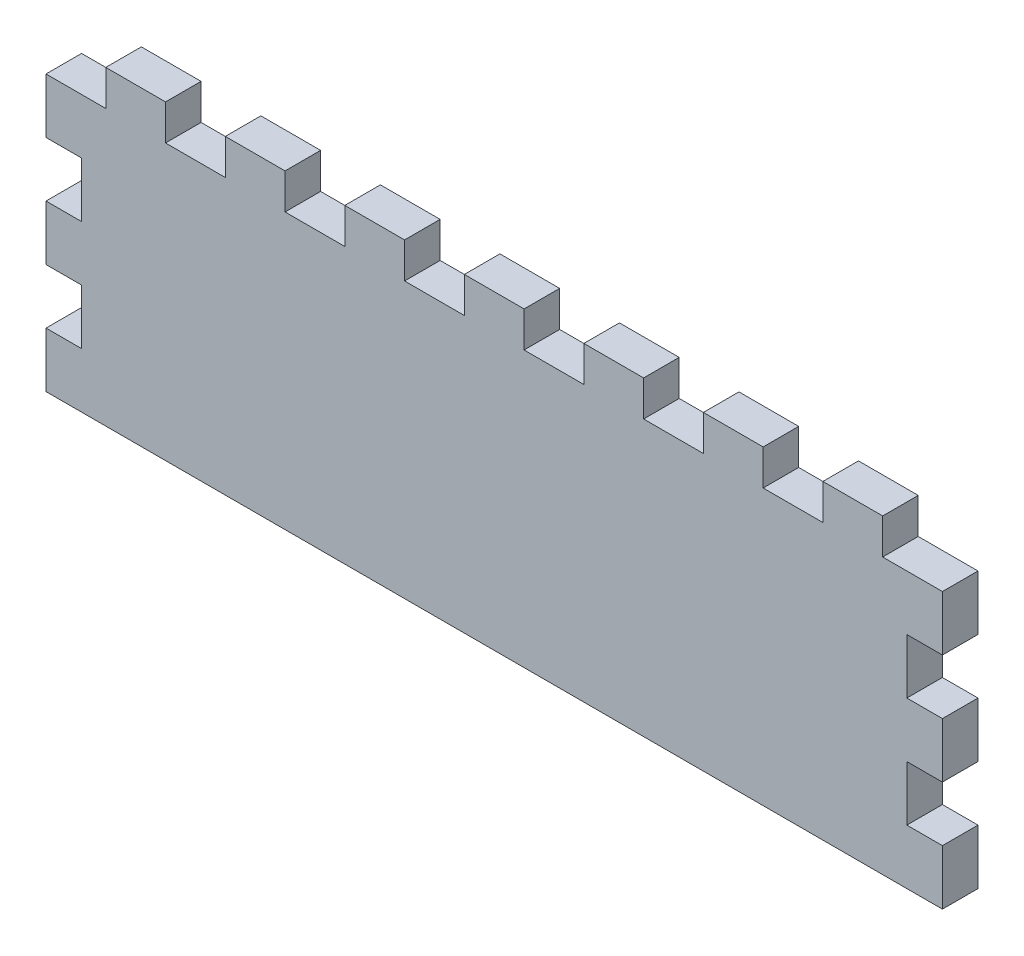
from build123d import *

# Parameters (mm, degrees)
SKETCH1_W               = 80
SKETCH1_H               = 80
BOSS_EXTRUDE1_DEPTH     = 3.175
CUT_EXTRUDE2_DEPTH      = 57.657573413
CUT_EXTRUDE2_DEPTH_BACK = 57.657573413
SKETCH3_W               = 5.333333333
SKETCH3_H               = 3.175
SKETCH3_W_2             = 3.175
SKETCH3_H_2             = 4.91
SKETCH3_W_3             = 5.333333334
SKETCH4_W               = 80.351781832
SKETCH4_H               = 52.368780003
CUT_EXTRUDE3_DEPTH      = 57.657573413


with BuildPart() as part:
    # Sketch1 → Boss-Extrude1 (new body)
    with BuildSketch(Plane.XY):
        Rectangle(SKETCH1_W, SKETCH1_H)
    extrude(amount=BOSS_EXTRUDE1_DEPTH)

    # Sketch3 → Cut-Extrude2 (cut, two sides: drawn at the far end of the back side and taken through both)
    with BuildSketch(Plane.XY.offset(3.175).offset(-CUT_EXTRUDE2_DEPTH_BACK)):
        with Locations((-37.333333334, -38.4125)):
            Rectangle(SKETCH3_W, SKETCH3_H)
        with Locations((-26.666666666, -38.4125)):
            Rectangle(SKETCH3_W, SKETCH3_H)
        with Locations((-38.4125, -29.46)):
            Rectangle(SKETCH3_W_2, SKETCH3_H_2)
        with Locations((-16, -38.4125)):
            Rectangle(SKETCH3_W_3, SKETCH3_H)
        with Locations((-38.4125, -19.64)):
            Rectangle(SKETCH3_W_2, SKETCH3_H_2)
        with Locations((-5.333333334, -38.4125)):
            Rectangle(SKETCH3_W, SKETCH3_H)
        with Locations((-38.4125, -9.82)):
            Rectangle(SKETCH3_W_2, SKETCH3_H_2)
        with Locations((5.333333334, -38.4125)):
            Rectangle(SKETCH3_W, SKETCH3_H)
        with Locations((-38.4125, 0)):
            Rectangle(SKETCH3_W_2, SKETCH3_H_2)
        with Locations((16, -38.4125)):
            Rectangle(SKETCH3_W_3, SKETCH3_H)
        with Locations((-38.4125, 9.82)):
            Rectangle(SKETCH3_W_2, SKETCH3_H_2)
        with Locations((26.666666666, -38.4125)):
            Rectangle(SKETCH3_W, SKETCH3_H)
        with Locations((-38.4125, 19.64)):
            Rectangle(SKETCH3_W_2, SKETCH3_H_2)
        with Locations((37.333333334, -38.4125)):
            Rectangle(SKETCH3_W, SKETCH3_H)
        with Locations((-38.4125, 29.46)):
            Rectangle(SKETCH3_W_2, SKETCH3_H_2)
        with Locations((-37.333333334, 38.4125)):
            Rectangle(SKETCH3_W, SKETCH3_H)
        with Locations((38.4125, -29.46)):
            Rectangle(SKETCH3_W_2, SKETCH3_H_2)
        with Locations((38.4125, -19.64)):
            Rectangle(SKETCH3_W_2, SKETCH3_H_2)
        with Locations((-26.666666666, 38.4125)):
            Rectangle(SKETCH3_W, SKETCH3_H)
        with Locations((38.4125, -9.82)):
            Rectangle(SKETCH3_W_2, SKETCH3_H_2)
        with Locations((-16, 38.4125)):
            Rectangle(SKETCH3_W_3, SKETCH3_H)
        with Locations((38.4125, 0)):
            Rectangle(SKETCH3_W_2, SKETCH3_H_2)
        with Locations((-5.333333334, 38.4125)):
            Rectangle(SKETCH3_W, SKETCH3_H)
        with Locations((38.4125, 9.82)):
            Rectangle(SKETCH3_W_2, SKETCH3_H_2)
        with Locations((5.333333334, 38.4125)):
            Rectangle(SKETCH3_W, SKETCH3_H)
        with Locations((38.4125, 19.64)):
            Rectangle(SKETCH3_W_2, SKETCH3_H_2)
        with Locations((16, 38.4125)):
            Rectangle(SKETCH3_W_3, SKETCH3_H)
        with Locations((38.4125, 29.46)):
            Rectangle(SKETCH3_W_2, SKETCH3_H_2)
        with Locations((26.666666666, 38.4125)):
            Rectangle(SKETCH3_W, SKETCH3_H)
        with Locations((37.333333334, 38.4125)):
            Rectangle(SKETCH3_W, SKETCH3_H)
    extrude(amount=CUT_EXTRUDE2_DEPTH + CUT_EXTRUDE2_DEPTH_BACK, mode=Mode.SUBTRACT)

    # Sketch4 → Cut-Extrude3 (cut, through all)
    with BuildSketch(Plane.XY.offset(3.175)):
        with Locations((0.175890916, -13.909390002)):
            Rectangle(SKETCH4_W, SKETCH4_H)
    extrude(amount=-CUT_EXTRUDE3_DEPTH, mode=Mode.SUBTRACT)


solid = part.part
